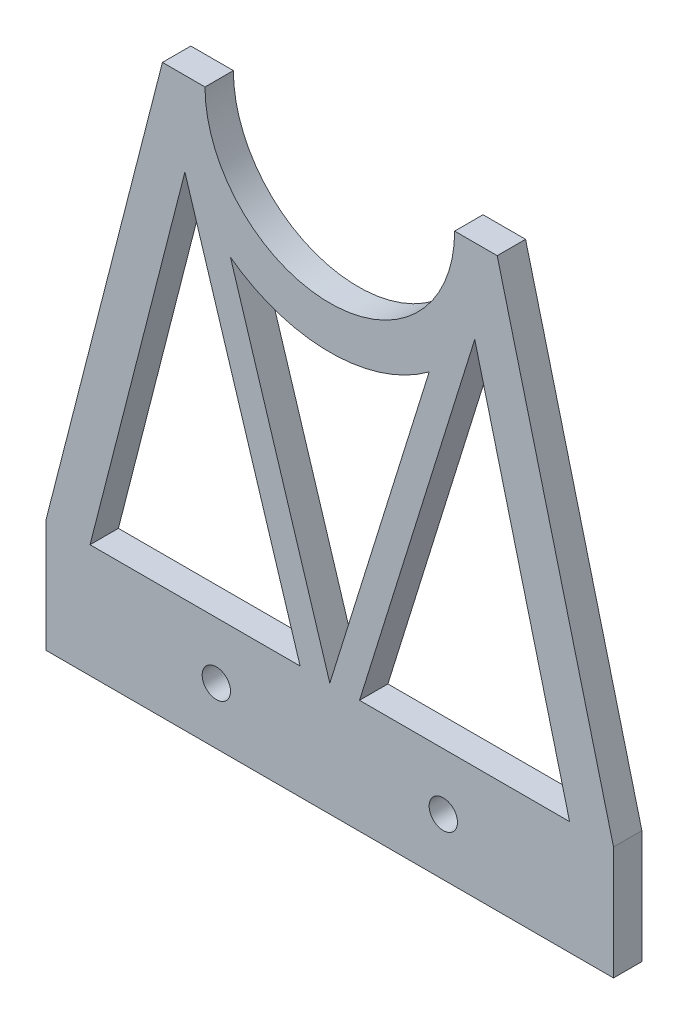
from build123d import *

# Parameters (mm, degrees)
BOSS_EXTRUDE1_DEPTH = 6.35
SKETCH2_R           = 3.175
CUT_EXTRUDE1_DEPTH  = 18.415


with BuildPart() as part:
    # Sketch1 → Boss-Extrude1 (new body)
    with BuildSketch(Plane.XY):
        with BuildLine():
            Line((-27.94, 70.104), (-37.465, 70.104))
            Line((-37.465, 70.104), (-63.5, -31.496))
            Line((-63.5, -31.496), (-63.5, -56.896))
            Line((-63.5, -56.896), (63.5, -56.896))
            Line((63.5, -56.896), (63.5, -31.496))
            Line((63.5, -31.496), (37.465, 70.104))
            Line((37.465, 70.104), (27.94, 70.104))
            ThreePointArc((27.94, 70.104), (0, 42.164), (-27.94, 70.104))
        make_face()
        Polygon((53.667246667, -31.496), (6.6504394, -31.496), (28.29998163, 38.06486673), (32.43650344, 51.355680886), align=None, mode=Mode.SUBTRACT)
        Polygon((-32.43650344, 51.355680886), (-53.667246667, -31.496), (-6.6504394, -31.496), (-28.29998163, 38.06486673), align=None, mode=Mode.SUBTRACT)
        with BuildLine():
            Line((0, -31.496), (22.236848418, 39.951905588))
            ThreePointArc((22.236848418, 39.951905588), (0, 32.639), (-22.236848418, 39.951905588))
            Line((-22.236848418, 39.951905588), (0, -31.496))
        make_face(mode=Mode.SUBTRACT)
    extrude(amount=BOSS_EXTRUDE1_DEPTH)

    # Sketch2 → Cut-Extrude1 (cut)
    with BuildSketch(Plane.XY.offset(6.35)):
        with Locations((-25.4, -44.196)):
            Circle(SKETCH2_R)
        with Locations((25.4, -44.196)):
            Circle(SKETCH2_R)
    extrude(amount=-CUT_EXTRUDE1_DEPTH, mode=Mode.SUBTRACT)


solid = part.part
